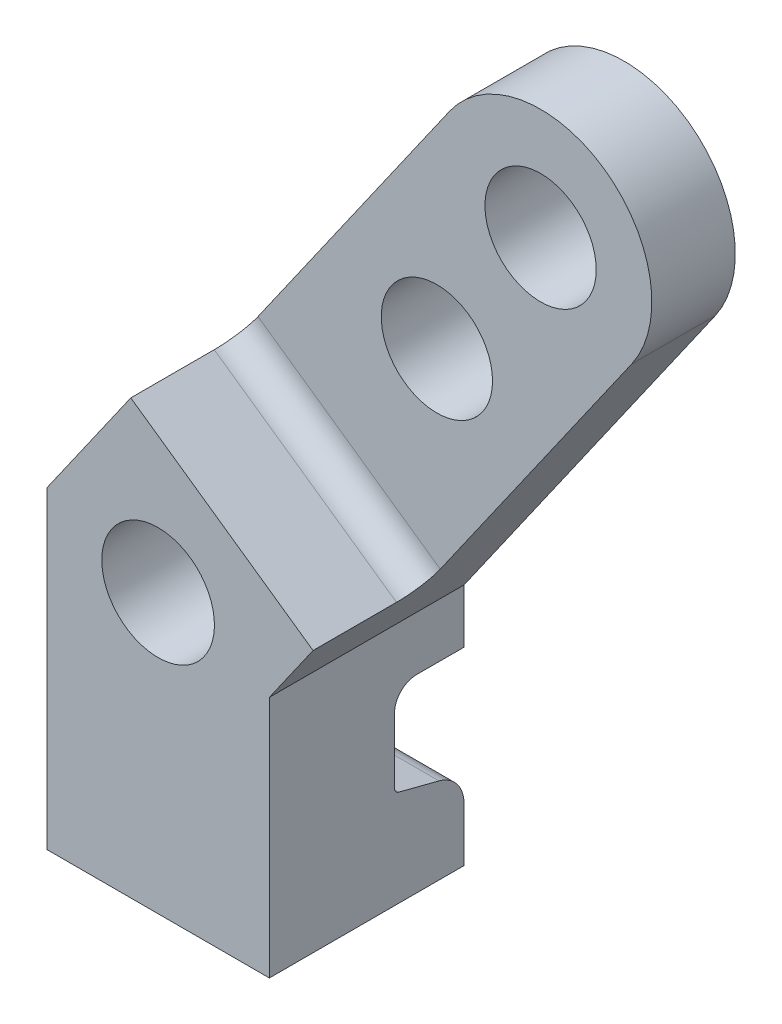
from build123d import *

# Parameters (mm, degrees)
SKETCH_1_R          = 20.25
SKETCH_1_R_2        = 20
EXTRUDE_1_DEPTH     = 70
CUT_EXTRUDE_1_DEPTH = 40
CUT_EXTRUDE_2_DEPTH = 262.804787716
FILLET_1_R          = 12
FILLET_2_R          = 2
FILLET_3_R          = 8
FILLET_4_R          = 10
SKETCH_5_W          = 70
SKETCH_5_H          = 300
CUT_EXTRUDE_4_DEPTH = 262.804787716


with BuildPart() as part:
    # 草图1 → 凸台-拉伸1 (new body)
    with BuildSketch(Plane.XY):
        with BuildLine():
            Line((64.741912408, 162.198904983), (-40, 12.611951555))
            Line((-40, 12.611951555), (-40, -100))
            Line((-40, -100), (40, -100))
            Line((40, -100), (40, -12.611951555))
            Line((40, -12.611951555), (130.274075951, 116.312790075))
            ThreePointArc((130.274075951, 116.312790075), (120.451051634, 172.021929301), (64.741912408, 162.198904983))
        make_face()
        Circle(SKETCH_1_R, mode=Mode.SUBTRACT)
        with Locations((97.50799418, 139.255847529)):
            Circle(SKETCH_1_R_2, mode=Mode.SUBTRACT)
        with Locations((60.225525817, 86.01096465)):
            Circle(SKETCH_1_R_2, mode=Mode.SUBTRACT)
    extrude(amount=EXTRUDE_1_DEPTH)

    # 草图2 → 切除-拉伸1 (cut)
    with BuildSketch(Plane.XY):
        Polygon((-9.823024318, 55.709139226), (55.709139226, 9.823024318), (170.424426496, 173.653433175), (104.892262953, 219.539548083), align=None)
    extrude(amount=CUT_EXTRUDE_1_DEPTH, mode=Mode.SUBTRACT)

    # 草图3 → 切除-拉伸2 (cut, through all)
    with BuildSketch(Plane.ZY.offset(40)):
        Polygon((70, -32), (45, -32), (45, -65), (70, -71.454972244), align=None)
    extrude(amount=-CUT_EXTRUDE_2_DEPTH, mode=Mode.SUBTRACT)

    # 圆角1
    fillet_1_edges = [part.edges().sort_by_distance(p)[0] for p in [
        (0, -71.454972244, 70),
    ]]
    fillet(fillet_1_edges, radius=FILLET_1_R)

    # 圆角2
    fillet_2_edges = [part.edges().sort_by_distance(p)[0] for p in [
        (0, -65, 45),
    ]]
    fillet(fillet_2_edges, radius=FILLET_2_R)

    # 圆角3
    fillet_3_edges = [part.edges().sort_by_distance(p)[0] for p in [
        (0, -32, 45),
    ]]
    fillet(fillet_3_edges, radius=FILLET_3_R)

    # 圆角4
    fillet_4_edges = [part.edges().sort_by_distance(p)[0] for p in [
        (22.943057454, 32.766081772, 40),
    ]]
    fillet(fillet_4_edges, radius=FILLET_4_R)

    # 镜向1: part across plane


with BuildPart() as part_1:
    add(part.part)
    add(part.part.mirror(Plane(origin=(97.50799418, 139.255847529, 0), x_dir=(1, 0, 0), z_dir=(0, 0, -1))))

    # 草图5 → 切除-拉伸4 (cut, through all)
    with BuildSketch(Plane.ZY.offset(40)):
        with Locations((35, 50)):
            Rectangle(SKETCH_5_W, SKETCH_5_H)
    extrude(amount=-CUT_EXTRUDE_4_DEPTH, mode=Mode.SUBTRACT)


solid = part_1.part
